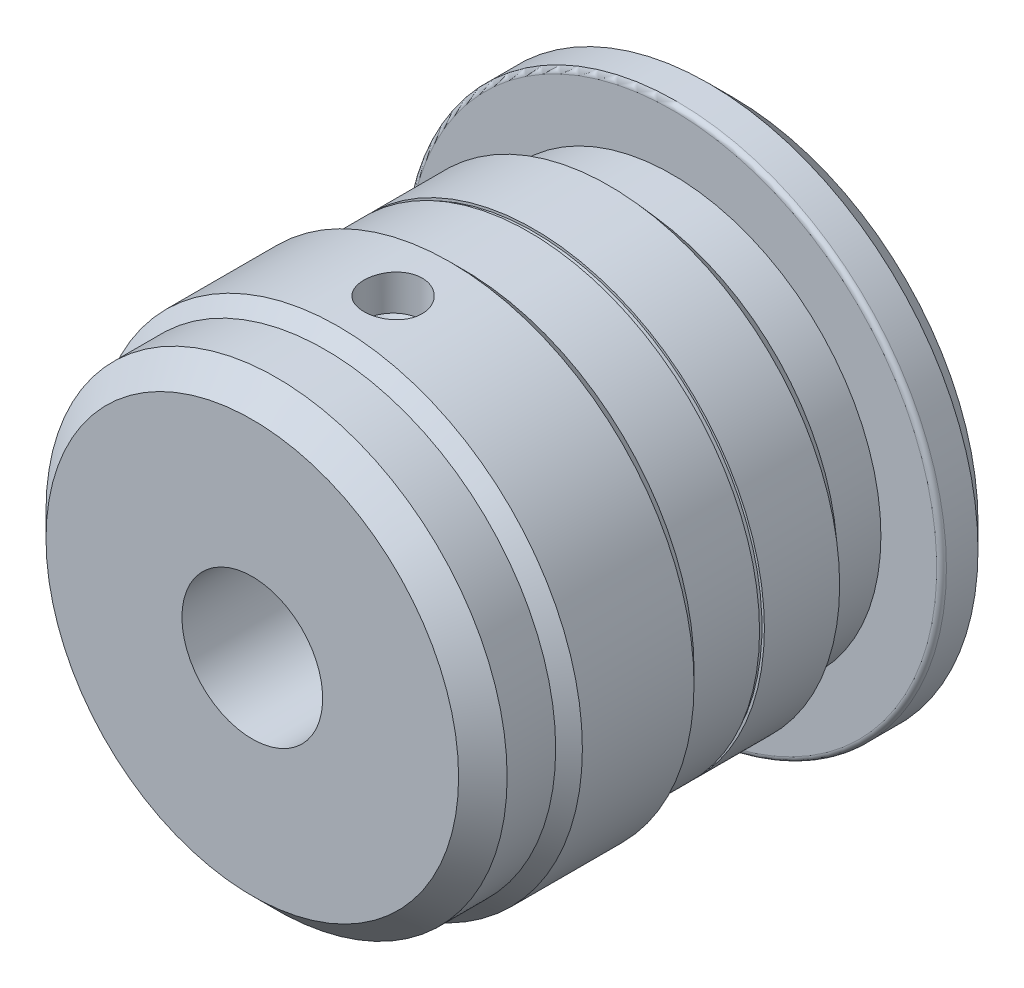
from build123d import *

# Parameters (mm, degrees)
CHAMFER_1_SIZE                       = 1
CHAMFER_2_SIZE                       = 1
FILLET_1_R                           = 0.2
SKETCH_5_R                           = 1.2
CUT_EXTRUDE_2_DEPTH                  = 2
CHAMFER_3_SIZE                       = 0.5
PATTERN_CIRCULAR_1_COUNT             = 2
CHAMFER_3_OF_PATTERN_CIRCULAR_1_SIZE = 0.5


with BuildPart() as part:
    # 스케치3 → 회전2 (revolve)
    with BuildSketch(Plane(origin=(0, 0, 0), x_dir=(1, 0, 0), z_dir=(0, 1, 0)), mode=Mode.PRIVATE) as revolve_2_sk:
        Polygon((11.1, 0), (11.1, -2.5), (8.6, -2.5), (8.6, -4.3), (9.5, -5.1), (9.5, -8.2), (9.4, -8.2), (9.4, -8.4), (9.5, -8.4), (9.5, -11.1), (10.05, -11.65), (10.05, -16.25), (9.5, -16.8), (9.5, -19.8), (2.9, -19.8), (2.9, -11.8), (4.4, -11.8), (4.4, -10), (3.4, -10), (3.4, -8.5), (6.1, -7.77653718), (6.1, 0), align=None)
    revolve(revolve_2_sk.sketch.rotate(Axis((0, 0, 0), (0, 0, 1)), 180), axis=Axis((0, 0, 0), (0, 0, 1)))

    # 모따기1
    chamfer_1_edges = [part.edges().sort_by_distance(p)[0] for p in [
        (6.1, 0, 0),
        (9.5, 0, 19.8),
    ]]
    chamfer(chamfer_1_edges, length=CHAMFER_1_SIZE)

    # 모따기2
    chamfer_2_edges = [part.edges().sort_by_distance(p)[0] for p in [
        (11.1, 0, 0),
    ]]
    chamfer(chamfer_2_edges, length=CHAMFER_2_SIZE)

    # 필렛1
    fillet_1_edges = [part.edges().sort_by_distance(p)[0] for p in [
        (11.1, 0, 2.5),
    ]]
    fillet(fillet_1_edges, radius=FILLET_1_R)

    # 스케치5 → 컷-돌출2 (cut)
    with BuildSketch(Plane(origin=(0, 10.05, 0), x_dir=(1, 0, 0), z_dir=(0, 1, 0))):
        with Locations(Location((0, -14, 0), (0, 0, 270))):
            Circle(SKETCH_5_R)
    cut_extrude_2 = extrude(amount=-CUT_EXTRUDE_2_DEPTH, mode=Mode.SUBTRACT)

    # 모따기3
    chamfer_3_edges = [part.edges().sort_by_distance(p)[0] for p in [
        (0, 8.05, 12.8),
    ]]
    chamfer(chamfer_3_edges, length=CHAMFER_3_SIZE)

    # 원형 패턴1: 컷-돌출2 ×2 about axis
    pattern_circular_1_axis = Axis((0, 0, 0), (0, 0, -1))
    for i in range(1, PATTERN_CIRCULAR_1_COUNT):
        add(cut_extrude_2.rotate(pattern_circular_1_axis, i * 360 / PATTERN_CIRCULAR_1_COUNT), mode=Mode.SUBTRACT)

    # 모따기3 of 원형 패턴1
    chamfer_3_of_pattern_circular_1_edges = [part.edges().sort_by_distance(p)[0] for p in [
        (0, -8.05, 12.8),
    ]]
    chamfer(chamfer_3_of_pattern_circular_1_edges, length=CHAMFER_3_OF_PATTERN_CIRCULAR_1_SIZE)


solid = part.part
